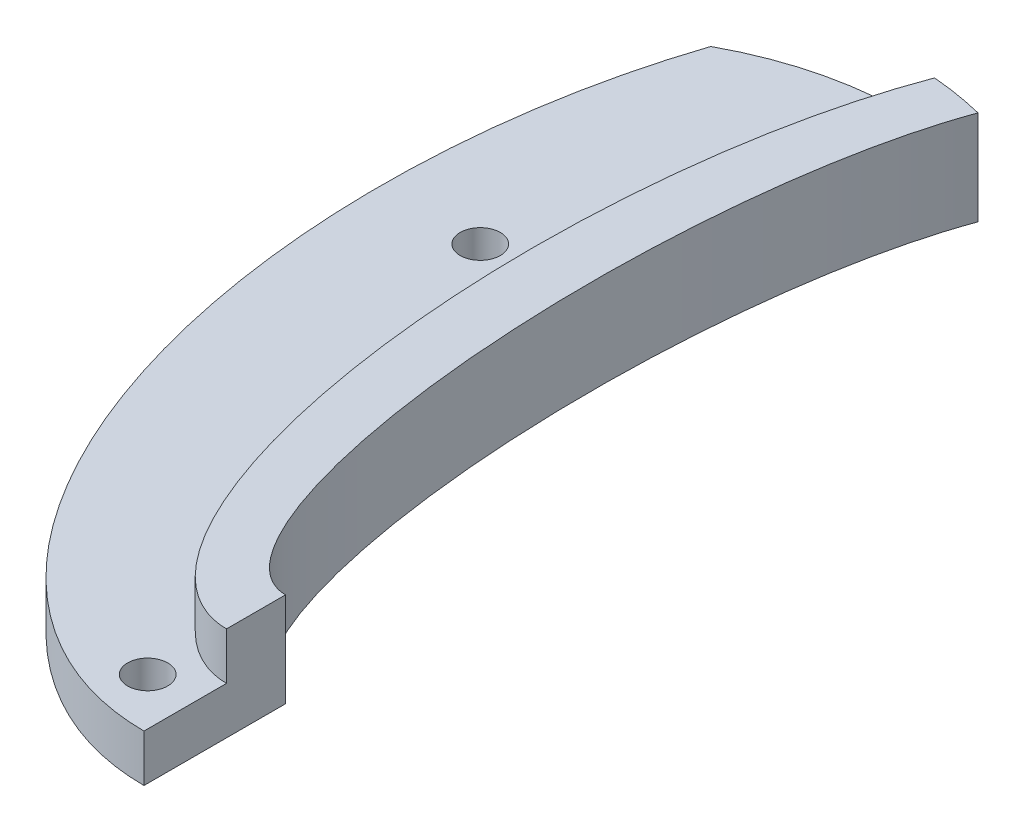
from build123d import *

# Parameters (mm, degrees)
SKETCH_1_R           = 1.7
EXTRUDE_1_DEPTH      = 4
EXTRUDE_2_DEPTH      = 4
EXTRUDE_2_DEPTH_BACK = 4


with BuildPart() as part:
    # Эскиз1 → Бобышка-Вытянуть1 (new body)
    with BuildSketch(Plane(origin=(0, 0, 0), x_dir=(1, 0, 0), z_dir=(0, 1, 0))):
        with BuildLine():
            Line((0, -50), (0, -43))
            add(Edge.make_bspline(
                [(-10.000145873, 27.475174978), (-27.697978685, -43), (0, -43)],
                knots=[4.019246634, 4.019246634, 4.019246634, 6.283185307, 6.283185307, 6.283185307], degree=2, weights=[1, 0.42487789, 1]))
            ThreePointArc((-10.000145873, 27.475174978), (-18.360814479, 27.113576543), (-26.230013338, 24.266254592))
            add(Edge.make_bspline(
                [(-26.230013338, 24.266254592), (-50.964235719, -50), (0, -50)],
                knots=[4.205654034, 4.205654034, 4.205654034, 6.283185307, 6.283185307, 6.283185307], degree=2, weights=[1, 0.507284392, 1]))
        make_face()
        with Locations((-3.997292475, -45.689262056)):
            Circle(SKETCH_1_R, mode=Mode.SUBTRACT)
        with Locations((-21.5, 0)):
            Circle(SKETCH_1_R, mode=Mode.SUBTRACT)
    extrude(amount=EXTRUDE_1_DEPTH)

    # Эскиз2 → Бобышка-Вытянуть2 (add, two sides: drawn at the far end of the back side and taken through both)
    with BuildSketch(Plane(origin=(0, 4, 0), x_dir=(1, 0, 0), z_dir=(0, 1, 0)).offset(-EXTRUDE_2_DEPTH_BACK)):
        with BuildLine():
            Line((0, -38), (0, -43))
            add(Edge.make_bspline(
                [(-10.438251501, 27.444344811), (-37.035399945, -43), (0, -43)],
                knots=[3.911241966, 3.911241966, 3.911241966, 6.283185307, 6.283185307, 6.283185307], degree=2, weights=[1, 0.375396623, 1]))
            ThreePointArc((-10.438251501, 27.444344811), (-8.2192487, 27.171324469), (-6.029573118, 26.71984426))
            add(Edge.make_bspline(
                [(-6.029573118, 26.71984426), (-29.815932514, -38), (0, -38)],
                knots=[3.788795549, 3.788795549, 3.788795549, 6.283185307, 6.283185307, 6.283185307], degree=2, weights=[1, 0.317983135, 1]))
        make_face()
    extrude(amount=EXTRUDE_2_DEPTH + EXTRUDE_2_DEPTH_BACK)


solid = part.part
